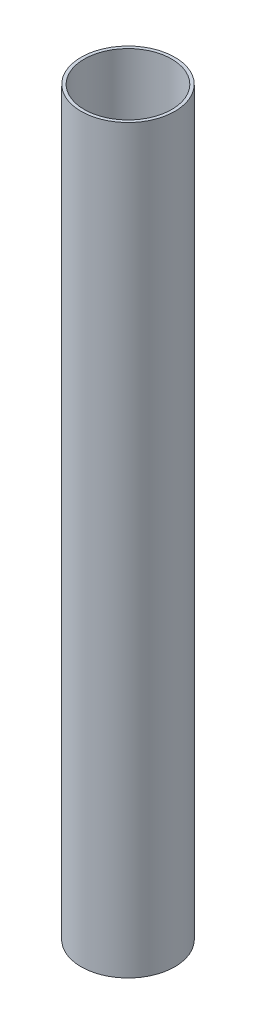
from build123d import *

# Parameters (mm, degrees)
SKETCH1_R           = 22.5
SKETCH1_R_2         = 21
BOSS_EXTRUDE1_DEPTH = 355.6


with BuildPart() as part:
    # Sketch1 → Boss-Extrude1 (new body)
    with BuildSketch(Plane(origin=(0, 0, 0), x_dir=(1, 0, 0), z_dir=(0, 1, 0))):
        with Locations(Location((0, 0, 0), (0, 0, 270))):
            Circle(SKETCH1_R)
        with Locations(Location((0, 0, 0), (0, 0, 270))):
            Circle(SKETCH1_R_2, mode=Mode.SUBTRACT)
    extrude(amount=BOSS_EXTRUDE1_DEPTH)


solid = part.part
